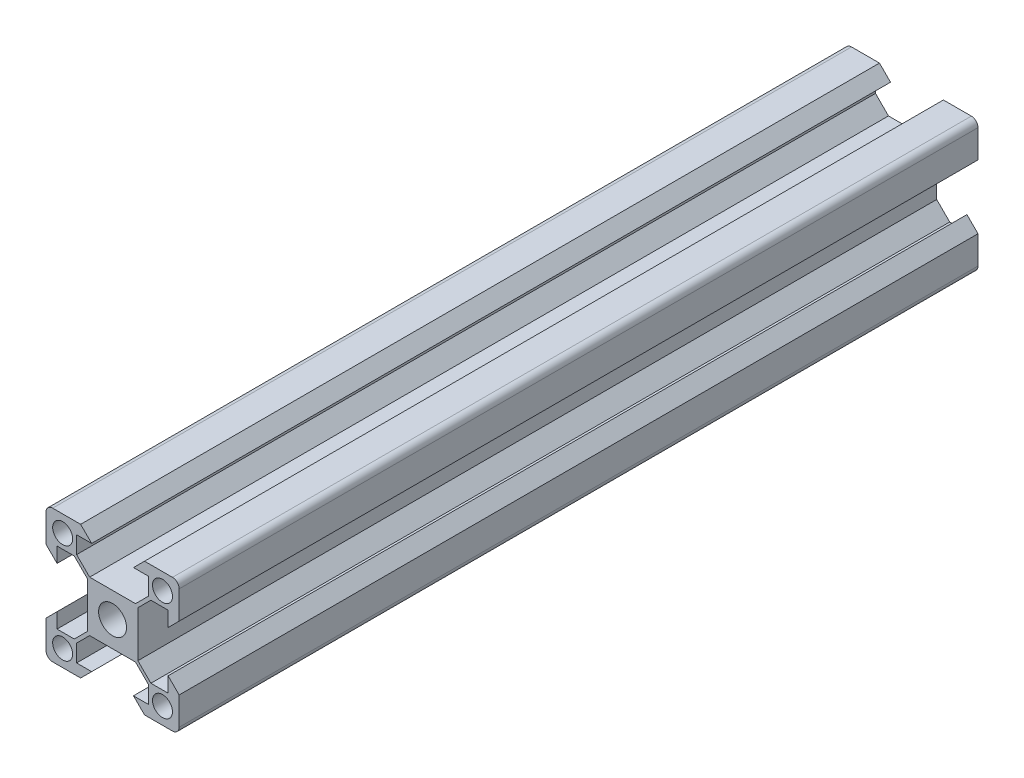
from build123d import *

# Parameters (mm, degrees)
SKETCH_1_R      = 1.5
SKETCH_1_R_2    = 2.1
EXTRUDE_1_DEPTH = 60
FILLET_1_R      = 1


with BuildPart() as part:
    # 草图1 → 凸台-拉伸1 (new, symmetric)
    with BuildSketch(Plane.XY):
        Polygon((-10, 10), (-10, 4.8), (-8.34, 3.14), (-8.34, 5.4), (-5.753553391, 5.4), (-3.8, 3.446446609), (-3.8, -3.446446609), (-5.753553391, -5.4), (-8.34, -5.4), (-8.34, -3.14), (-10, -4.8), (-10, -10), (-4.8, -10), (-3.14, -8.34), (-5.4, -8.34), (-5.4, -5.753553391), (-3.446446609, -3.8), (3.446446609, -3.8), (5.4, -5.753553391), (5.4, -8.34), (3.14, -8.34), (4.8, -10), (10, -10), (10, -4.8), (8.34, -3.14), (8.34, -5.4), (5.753553391, -5.4), (3.8, -3.446446609), (3.8, 3.446446609), (5.753553391, 5.4), (8.34, 5.4), (8.34, 3.14), (10, 4.8), (10, 10), (4.8, 10), (3.14, 8.34), (5.4, 8.34), (5.4, 5.753553391), (3.446446609, 3.8), (-3.446446609, 3.8), (-5.4, 5.753553391), (-5.4, 8.34), (-3.14, 8.34), (-4.8, 10), align=None)
        with Locations((-7.5, 7.5)):
            Circle(SKETCH_1_R, mode=Mode.SUBTRACT)
        Circle(SKETCH_1_R_2, mode=Mode.SUBTRACT)
        with Locations(Location((-7.5, -7.5, 0), (0, 0, 180))):
            Circle(SKETCH_1_R, mode=Mode.SUBTRACT)
        with Locations((7.5, -7.5)):
            Circle(SKETCH_1_R, mode=Mode.SUBTRACT)
        with Locations(Location((7.5, 7.5, 0), (0, 0, 180))):
            Circle(SKETCH_1_R, mode=Mode.SUBTRACT)
    extrude(amount=EXTRUDE_1_DEPTH, both=True)

    # 圆角1
    fillet_1_edges = [part.edges().sort_by_distance(p)[0] for p in [
        (10, 10, 0),
        (10, -10, 0),
        (-10, -10, 0),
        (-10, 10, 0),
    ]]
    fillet(fillet_1_edges, radius=FILLET_1_R)


solid = part.part
